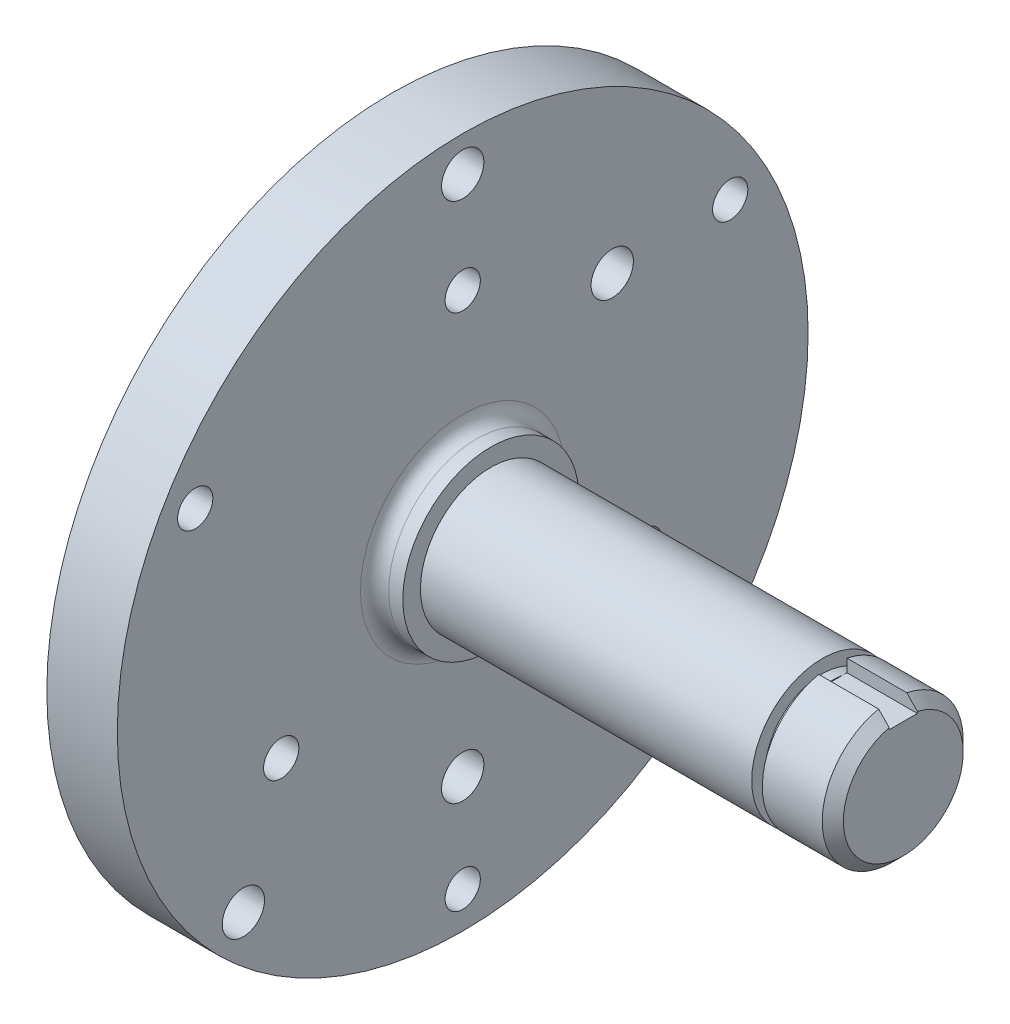
from build123d import *

# Parameters (mm, degrees)
ENL_V_MAT_EXTRU_1_REACH      = 102.291
ESQUISSE2_R                  = 3
TROU_TARAUD_M61_D            = 5
R_P_TITION_CIRCULAIRE1_COUNT = 3
ENL_V_MAT_EXTRU_4_REACH      = 102.291
ESQUISSE4_W                  = 4
ESQUISSE4_H                  = 4.231945228


with BuildPart() as part:
    # Esquisse1 → Révolution1 (revolve)
    with BuildSketch(Plane.XY, mode=Mode.PRIVATE) as r_volution1_sk:
        with BuildLine():
            Line((-14, 0), (-14, 49))
            Line((-14, 49), (-4, 49))
            Line((-4, 49), (-4, 14.5))
            ThreePointArc((-4, 14.5), (-3.414213562, 13.085786438), (-2, 12.5))
            Line((-2, 12.5), (0, 12.5))
            Line((0, 12.5), (0, 10))
            Line((0, 10), (47, 10))
            Line((47, 10), (47, 8.12772302))
            Line((47, 8.12772302), (48.5, 8.12772302))
            Line((48.5, 8.12772302), (48.5, 10))
            Line((48.5, 10), (57, 10))
            Line((57, 10), (58.5, 8.5))
            Line((58.5, 8.5), (58.5, 0))
            Line((58.5, 0), (-14, 0))
        make_face()
    revolve(r_volution1_sk.sketch.rotate(Axis((-18.286431075, 0, 0), (1, 0, 0)), 90), axis=Axis((-18.286431075, 0, 0), (1, 0, 0)))

    # Esquisse2 → Enlèv. mat.-Extru.1 (cut, up to next)
    with BuildSketch(Plane.ZY.offset(14), mode=Mode.PRIVATE) as enl_v_mat_extru_1_sk1:
        with Locations((0, -30)):
            Circle(ESQUISSE2_R)
    enl_v_mat_extru_1_tool1 = extrude(enl_v_mat_extru_1_sk1.sketch, amount=-ENL_V_MAT_EXTRU_1_REACH, mode=Mode.PRIVATE) & part.part
    # Esquisse2 → Enlèv. mat.-Extru.1 (cut, up to next)
    with BuildSketch(Plane.ZY.offset(14), mode=Mode.PRIVATE) as enl_v_mat_extru_1_sk2:
        with Locations((-21.213203436, 21.213203436)):
            Circle(ESQUISSE2_R)
    enl_v_mat_extru_1_tool2 = extrude(enl_v_mat_extru_1_sk2.sketch, amount=-ENL_V_MAT_EXTRU_1_REACH, mode=Mode.PRIVATE) & part.part
    # Esquisse2 → Enlèv. mat.-Extru.1 (cut, up to next)
    with BuildSketch(Plane.ZY.offset(14), mode=Mode.PRIVATE) as enl_v_mat_extru_1_sk3:
        with Locations((0, 44)):
            Circle(ESQUISSE2_R)
    enl_v_mat_extru_1_tool3 = extrude(enl_v_mat_extru_1_sk3.sketch, amount=-ENL_V_MAT_EXTRU_1_REACH, mode=Mode.PRIVATE) & part.part
    # Esquisse2 → Enlèv. mat.-Extru.1 (cut, up to next)
    with BuildSketch(Plane.ZY.offset(14), mode=Mode.PRIVATE) as enl_v_mat_extru_1_sk4:
        with Locations((31.112698372, -31.112698372)):
            Circle(ESQUISSE2_R)
    enl_v_mat_extru_1_tool4 = extrude(enl_v_mat_extru_1_sk4.sketch, amount=-ENL_V_MAT_EXTRU_1_REACH, mode=Mode.PRIVATE) & part.part
    add(enl_v_mat_extru_1_tool1.solids().sort_by_distance((-14, -30, 0))[0], mode=Mode.SUBTRACT)
    add(enl_v_mat_extru_1_tool2.solids().sort_by_distance((-14, 21.213203, -21.213203))[0], mode=Mode.SUBTRACT)
    add(enl_v_mat_extru_1_tool3.solids().sort_by_distance((-14, 44, 0))[0], mode=Mode.SUBTRACT)
    add(enl_v_mat_extru_1_tool4.solids().sort_by_distance((-14, -31.112698, 31.112698))[0], mode=Mode.SUBTRACT)

    # Trou taraudé M61 (through all)
    with Locations(Plane(origin=(-4, 29.732137495, 0), x_dir=(0, 0, 1), z_dir=(1, 0, 0))):
        with Locations((0, 0), (0, 73.549942095)):
            trou_taraud_m61 = Hole(TROU_TARAUD_M61_D / 2)

    # Répétition circulaire1: Trou taraudé M61 ×3 about axis
    r_p_tition_circulaire1_axis = Axis((0, 0, 0), (1, 0, 0))
    for i in range(1, R_P_TITION_CIRCULAIRE1_COUNT):
        add(trou_taraud_m61.rotate(r_p_tition_circulaire1_axis, i * 360 / R_P_TITION_CIRCULAIRE1_COUNT), mode=Mode.SUBTRACT)

    # Enlèv. mat.-Extru.4: up to this face of the body (flat: up to its plane)
    enl_v_mat_extru_4_end = Plane(part.part.faces().sort_by_distance((48.5, 0, -8.410565733))[0])
    # Esquisse4 → Enlèv. mat.-Extru.4 (cut, up to the picked face)
    with BuildSketch(Plane(origin=(58.5, 0, 0), x_dir=(0, 0, -1), z_dir=(1, 0, 0)), mode=Mode.PRIVATE) as enl_v_mat_extru_4_sk1:
        with Locations((0, 10.115972614)):
            Rectangle(ESQUISSE4_W, ESQUISSE4_H)
    enl_v_mat_extru_4_tool1 = split(extrude(enl_v_mat_extru_4_sk1.sketch, amount=-ENL_V_MAT_EXTRU_4_REACH, mode=Mode.PRIVATE), bisect_by=enl_v_mat_extru_4_end, keep=Keep.BOTH, mode=Mode.PRIVATE)
    add(enl_v_mat_extru_4_tool1.solids().sort_by(Axis((58.5, 10.115973, 0), (-1, 0, 0)))[0], mode=Mode.SUBTRACT)


solid = part.part
